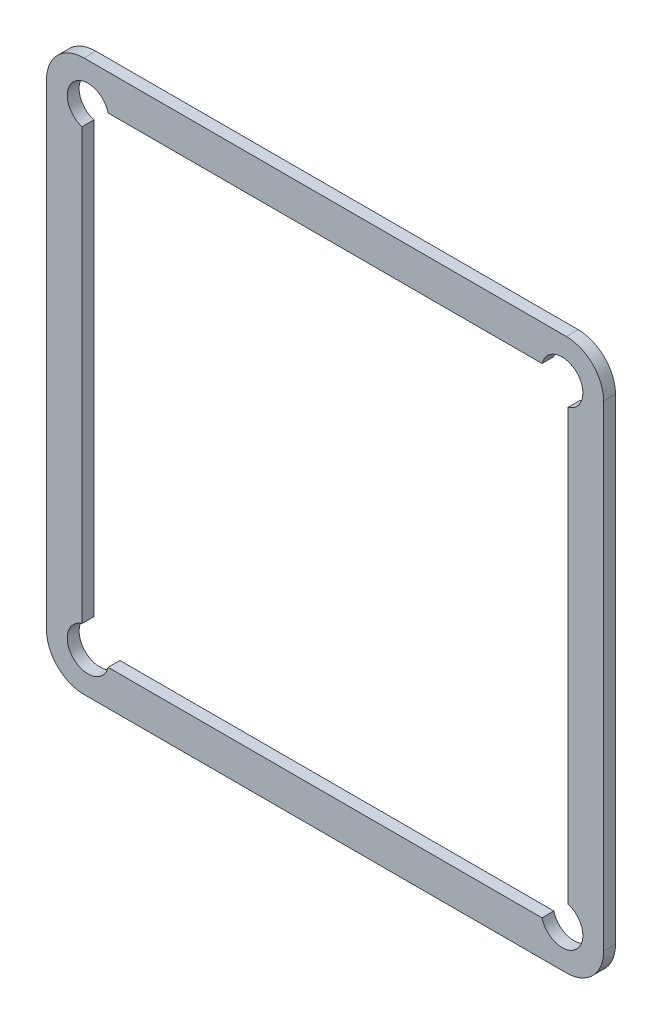
from build123d import *

# Parameters (mm, degrees)
ESQUISSE1_W      = 94
ESQUISSE1_H      = 93
EXTRUSION1_DEPTH = 2
CONG_1_R         = 6.3


with BuildPart() as part:
    # Esquisse1 → Extrusion1 (new body)
    with BuildSketch(Plane.XY):
        with Locations((47, -46.5)):
            Rectangle(ESQUISSE1_W, ESQUISSE1_H)
        with BuildLine():
            Line((88, -10.204101966), (88, -82.795898034))
            ThreePointArc((88, -82.795898034), (89.419273594, -88.67925192), (83.604782776, -87))
            Line((83.604782776, -87), (10.395217224, -87))
            ThreePointArc((10.395217224, -87), (4.580726406, -88.67925192), (6, -82.795898034))
            Line((6, -82.795898034), (6, -10.204101966))
            ThreePointArc((6, -10.204101966), (4.580726406, -4.32074808), (10.395217224, -6))
            Line((10.395217224, -6), (83.604782776, -6))
            ThreePointArc((83.604782776, -6), (89.419273594, -4.32074808), (88, -10.204101966))
        make_face(mode=Mode.SUBTRACT)
    extrude(amount=EXTRUSION1_DEPTH)

    # Congé1
    cong_1_edges = [part.edges().sort_by_distance(p)[0] for p in [
        (0, -93, 1),
        (0, 0, 1),
        (94, 0, 1),
        (94, -93, 1),
    ]]
    fillet(cong_1_edges, radius=CONG_1_R)


solid = part.part
